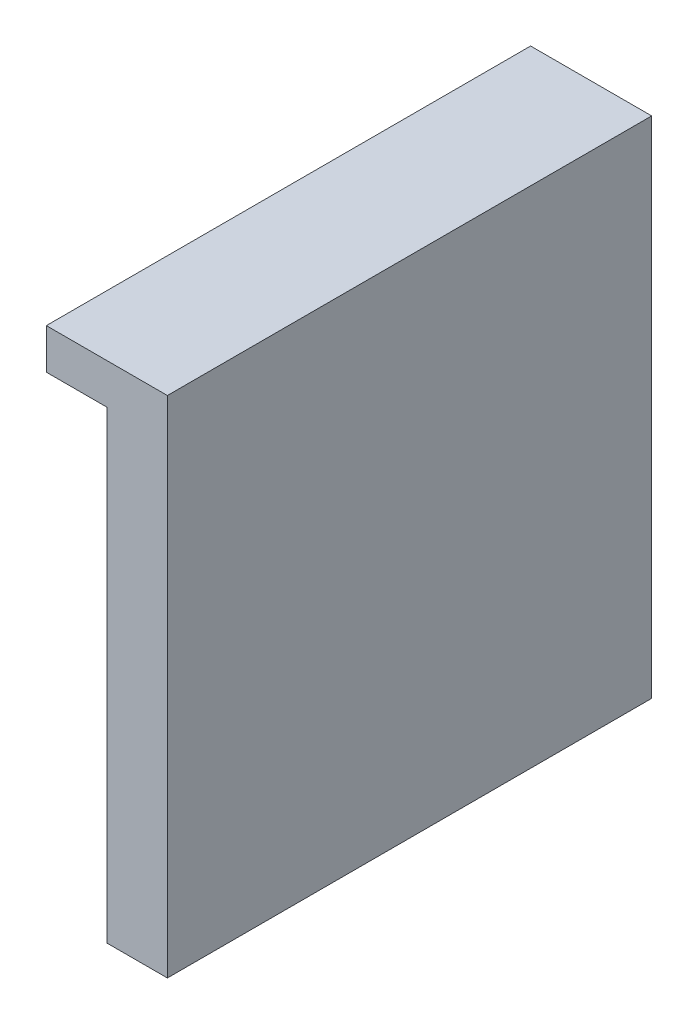
from build123d import *

# Parameters (mm, degrees)
SKETCH1_W           = 3
SKETCH1_H           = 24
BOSS_EXTRUDE1_DEPTH = 23
SKETCH2_W           = 6
SKETCH2_H           = 24
BOSS_EXTRUDE2_DEPTH = 2
SKETCH3_W           = 22
SKETCH3_H           = 9
CUT_EXTRUDE1_DEPTH  = 1


with BuildPart() as part:
    # Sketch1 → Boss-Extrude1 (new body)
    with BuildSketch(Plane(origin=(0, 0, 0), x_dir=(1, 0, 0), z_dir=(0, 1, 0))):
        with Locations((1.5, 12)):
            Rectangle(SKETCH1_W, SKETCH1_H)
    extrude(amount=BOSS_EXTRUDE1_DEPTH)

    # Sketch2 → Boss-Extrude2 (add)
    with BuildSketch(Plane(origin=(0, 23, 0), x_dir=(1, 0, 0), z_dir=(0, 1, 0))):
        with Locations((0, 12)):
            Rectangle(SKETCH2_W, SKETCH2_H)
    extrude(amount=BOSS_EXTRUDE2_DEPTH)

    # Sketch3 → Cut-Extrude1 (cut)
    with BuildSketch(Plane.ZY):
        with Locations((-12, 16.5)):
            Rectangle(SKETCH3_W, SKETCH3_H)
    extrude(amount=-CUT_EXTRUDE1_DEPTH, mode=Mode.SUBTRACT)


solid = part.part
